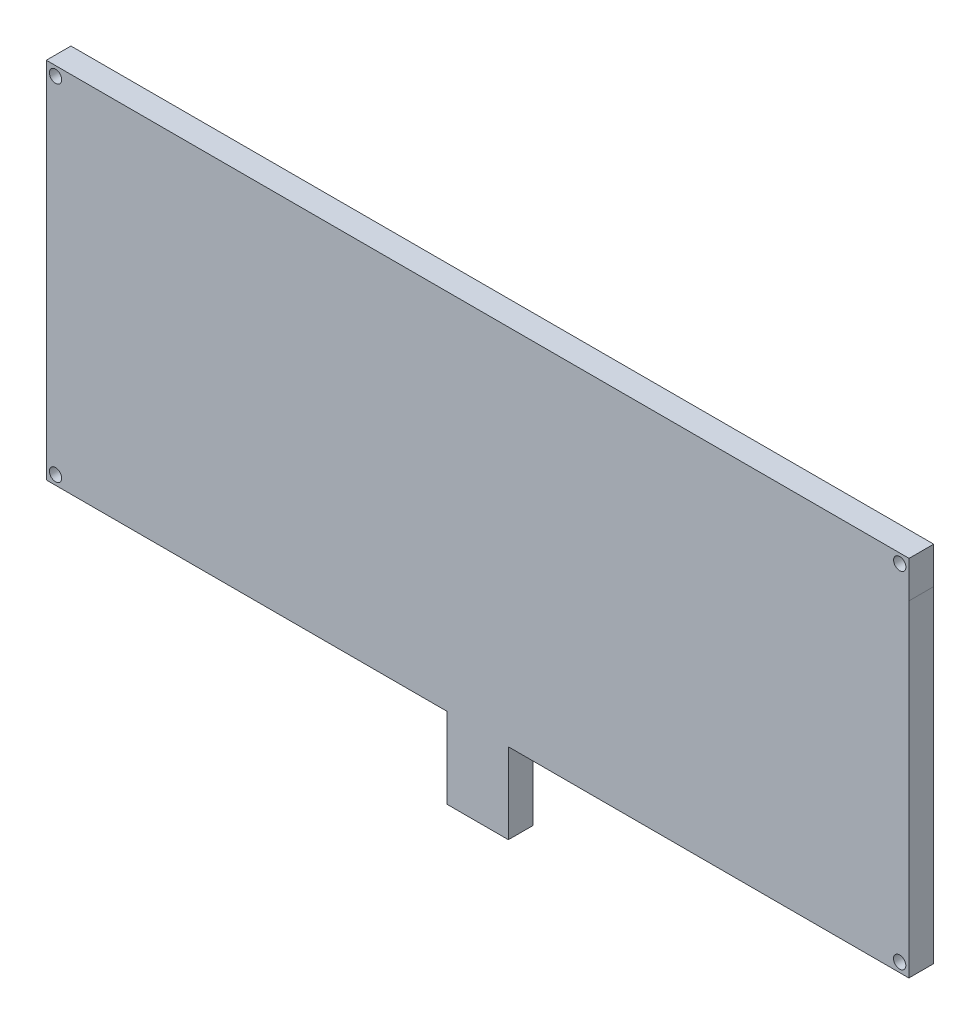
from build123d import *

# Parameters (mm, degrees)
BOSS_EXTRUDE1_DEPTH     = 4
SKETCH1_W               = 140
SKETCH1_H               = 53
BOSS_EXTRUDE2_DEPTH     = 4
BOSS_EXTRUDE3_DEPTH     = 4
CUT_EXTRUDE1_DEPTH      = 5
CUT_EXTRUDE1_DEPTH_BACK = 2
CUT_EXTRUDE4_DEPTH      = 81.533747288
CUT_EXTRUDE4_DEPTH_BACK = 81.533747288
SKETCH4_R               = 1


with BuildPart() as part:
    # Sketch3 → Boss-Extrude1 (new body)
    with BuildSketch(Plane.XY):
        Polygon((0, -26.5), (5, -26.5), (5, -39.566040215), (-4.99956385, -39.566040215), (-4.99956385, -26.566040215), (-4.99956385, -26.5), align=None)
    extrude(amount=BOSS_EXTRUDE1_DEPTH)

    # Sketch1 → Boss-Extrude2 (add)
    with BuildSketch(Plane.XY):
        Rectangle(SKETCH1_W, SKETCH1_H)
    extrude(amount=BOSS_EXTRUDE2_DEPTH)

    # Sketch5 → Boss-Extrude3 (add)
    with BuildSketch(Plane.XY):
        Polygon((-70, 26.5), (-70, 32.5), (70.030085777, 32.5), (70, 26.5), align=None)
    extrude(amount=BOSS_EXTRUDE3_DEPTH)

    # Sketch6 → Cut-Extrude1 (cut, two sides: drawn at the far end of the back side and taken through both)
    with BuildSketch(Plane.XY.offset(-CUT_EXTRUDE1_DEPTH_BACK)):
        with BuildLine():
            ThreePointArc((-67.496184759, 31), (-68.114088128, 31.924122375), (-69.204189088, 31.706208093))
            Line((-69.204189088, 31.706208093), (-67.78818043, 30.293791907))
            ThreePointArc((-67.78818043, 30.293791907), (-67.572062384, 30.617903369), (-67.496184759, 31))
        make_face()
        with BuildLine():
            Line((-67.78818043, 30.293791907), (-69.204189088, 31.706208093))
            ThreePointArc((-69.204189088, 31.706208093), (-69.202392852, 30.291995671), (-67.78818043, 30.293791907))
        make_face()
    extrude(amount=CUT_EXTRUDE1_DEPTH + CUT_EXTRUDE1_DEPTH_BACK, mode=Mode.SUBTRACT)

    # Sketch4 → Cut-Extrude4 (cut, two sides: drawn at the far end of the back side and taken through both)
    with BuildSketch(Plane.XY.offset(-CUT_EXTRUDE4_DEPTH_BACK)):
        with Locations((-68.496184759, -25)):
            Circle(SKETCH4_R)
        with Locations((68.503815241, -25)):
            Circle(SKETCH4_R)
        with Locations((68.518858129, 31)):
            Circle(SKETCH4_R)
    extrude(amount=CUT_EXTRUDE4_DEPTH + CUT_EXTRUDE4_DEPTH_BACK, mode=Mode.SUBTRACT)


solid = part.part
